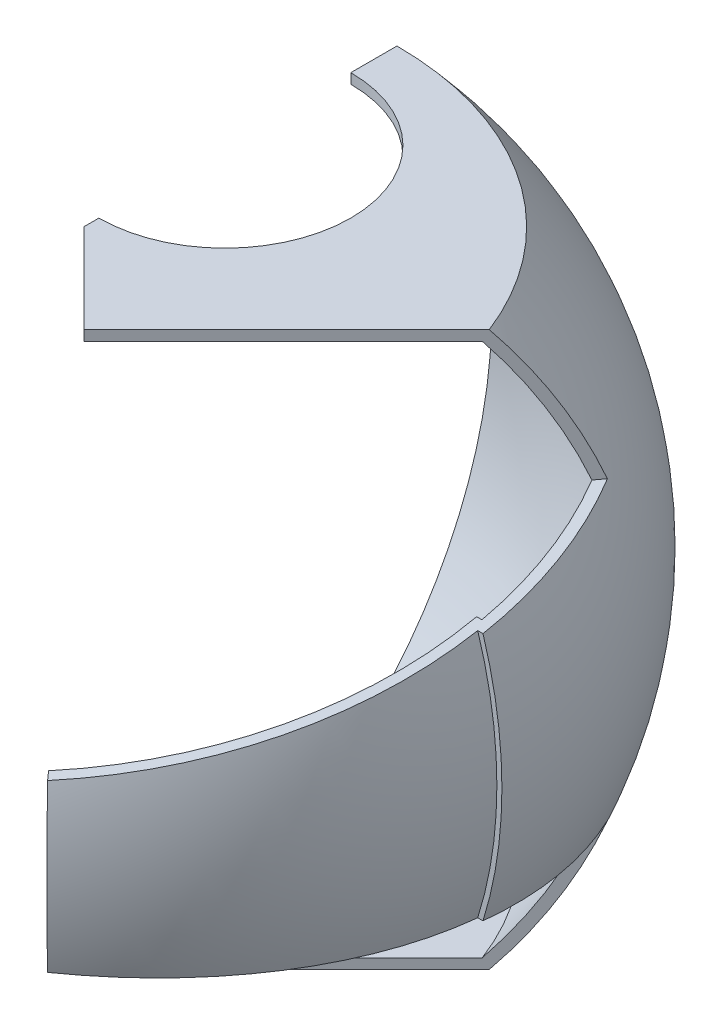
from build123d import *

# Parameters (mm, degrees)
REVOLVE1_ANGLE      = 180
CUT_EXTRUDE1_DEPTH  = 173.874496063
BOSS_EXTRUDE1_DEPTH = 100
CUT_EXTRUDE2_DEPTH  = 161.866404199
CUT_REVOLVE2_ANGLE  = 90
SKETCH7_R           = 25
CUT_EXTRUDE3_DEPTH  = 161.866404199
SHELL1_T            = -2


with BuildPart() as part:
    # Sketch1 → Revolve1 (revolve)
    with BuildSketch(Plane(origin=(0, 0, 0), x_dir=(0, 0, -1), z_dir=(1, 0, 0))):
        with BuildLine():
            Line((0, -55), (0, 55))
            Line((0, 55), (-76.60153846, 55))
            ThreePointArc((-76.60153846, 55), (-94.301620847, 0), (-76.60153846, -55))
            Line((-76.60153846, -55), (0, -55))
        make_face()
    revolve(axis=Axis((0, -55, 0), (0, 1, 0)), revolution_arc=REVOLVE1_ANGLE)

    # Sketch2 → Cut-Extrude1 (cut, through all)
    with BuildSketch(Plane.XZ.offset(55)):
        Polygon((0, 0), (17.67766953, 17.67766953), (110.975280637, -75.619941577), (110.975280637, 155.951540754), (-110.127783366, 155.951540754), (-110.127783366, 0), align=None)
    extrude(amount=-CUT_EXTRUDE1_DEPTH, mode=Mode.SUBTRACT)

    # Sketch3 → Boss-Extrude1 (add)
    with BuildSketch(Plane(origin=(100, 0, 0), x_dir=(0, 0, -1), z_dir=(1, 0, 0))):
        Polygon((-71.226029464, -15), (-71.226029464, 15), (39.011689542, 30), (39.011689542, -30), align=None)
    extrude(amount=-BOSS_EXTRUDE1_DEPTH)

    # Sketch4 → Cut-Revolve1 (revolve, cut)
    with BuildSketch(Plane(origin=(0, 0, 0), x_dir=(0, 0, -1), z_dir=(1, 0, 0))):
        with BuildLine():
            Line((-59.361204271, 58.010752688), (-134.505556561, 58.010752688))
            ThreePointArc((-134.505556561, 58.010752688), (-146.4820541, 0), (-134.505556561, -58.010752688))
            Line((-134.505556561, -58.010752688), (-59.361204271, -58.010752688))
            ThreePointArc((-59.361204271, -58.010752688), (-83, 0), (-59.361204271, 58.010752688))
        make_face()
    revolve(axis=Axis((0, 0, 0), (0, 1, 0)), mode=Mode.SUBTRACT)

    # Sketch5 → Cut-Extrude2 (cut, through all)
    with BuildSketch(Plane.XZ.offset(55)):
        Polygon((0, 0), (70.470143291, 80), (-50.338034401, 80), (-50.338034401, 0), align=None)
    extrude(amount=-CUT_EXTRUDE2_DEPTH, mode=Mode.SUBTRACT)

    # Sketch6 → Cut-Revolve2 (revolve, cut)
    with BuildSketch(Plane(origin=(0, 0, 0), x_dir=(0, 0, -1), z_dir=(1, 0, 0))):
        with BuildLine():
            Line((-48.985500868, 65.760327742), (-101.43758046, 65.760327742))
            ThreePointArc((-101.43758046, 65.760327742), (-120.888392471, 0), (-101.43758046, -65.760327742))
            Line((-101.43758046, -65.760327742), (-48.985500868, -65.760327742))
            ThreePointArc((-48.985500868, -65.760327742), (-82, 0), (-48.985500868, 65.760327742))
        make_face()
    revolve(axis=Axis((0, 0, 0), (0, 1, 0)), revolution_arc=CUT_REVOLVE2_ANGLE, mode=Mode.SUBTRACT)

    # Sketch7 → Cut-Extrude3 (cut, through all)
    with BuildSketch(Plane.XZ.offset(55)):
        with Locations((0, -28)):
            Circle(SKETCH7_R)
    extrude(amount=-CUT_EXTRUDE3_DEPTH, mode=Mode.SUBTRACT)

    # Shell1
    shell1_openings = [part.faces().sort_by_distance(p)[0] for p in [
        (0, 0, -65.508602259),
        (25, 0, -28),
        (8.951286878, 39.236848999, 8.951286878),
        (8.951286878, -39.236848999, 8.951286878),
        (53.49764896, 22.71356766, 14.537622511),
        (53.49764896, -22.71356766, 14.537622511),
        (40.440192864, 39.71059478, -5.084853804),
        (40.440192864, -39.71059478, -5.084853804),
        (0, 0, -1.5),
        (25.1022253, 0, 28.496863072),
    ]]
    offset(amount=SHELL1_T, openings=shell1_openings, kind=Kind.INTERSECTION)


solid = part.part
